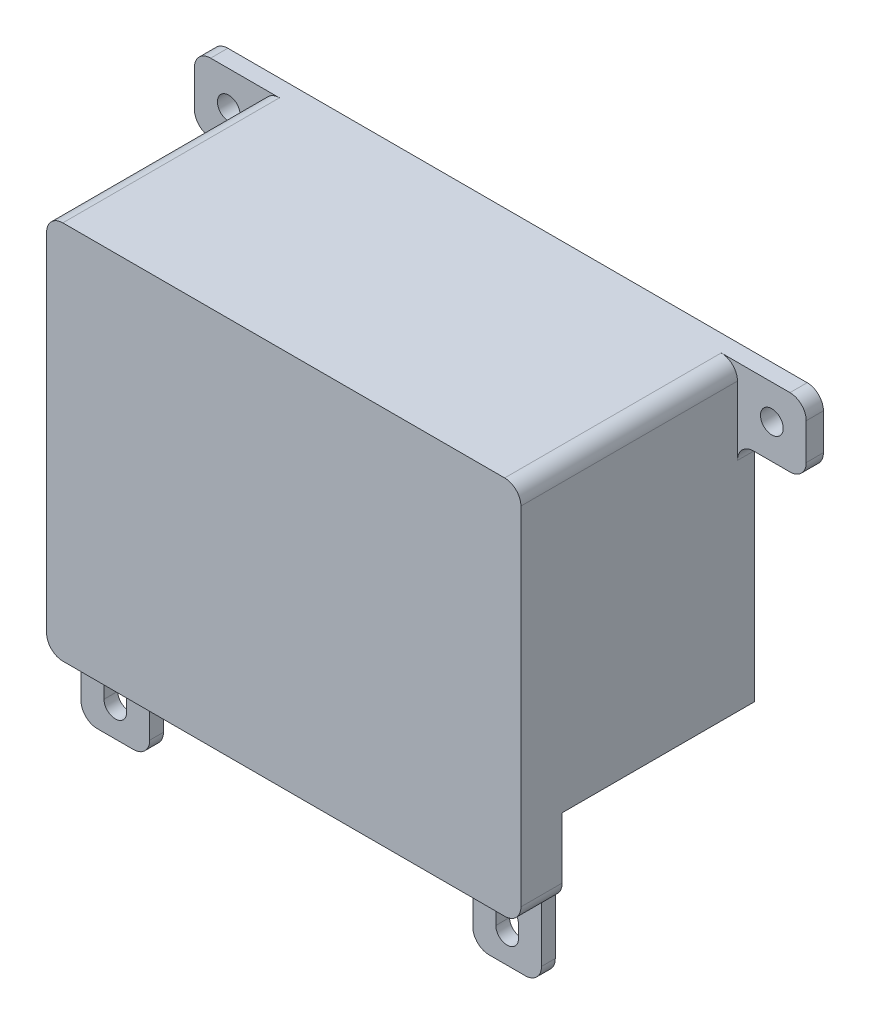
from build123d import *

# Parameters (mm, degrees)
SKETCH1_W           = 82.539998569
SKETCH1_H           = 65.04
BOSS_EXTRUDE1_DEPTH = 43.18
SHELL1_T            = 2.54
CUT_EXTRUDE2_DEPTH  = 124.028758627
SKETCH7_W           = 87.619998569
SKETCH7_H           = 43.18
BOSS_EXTRUDE2_DEPTH = 2.54
CUT_EXTRUDE3_DEPTH  = 2.54
CUT_EXTRUDE4_DEPTH  = 2.54
SKETCH10_W          = 1.27
SKETCH10_H          = 35.56
CUT_EXTRUDE5_DEPTH  = 2.54
SKETCH11_W          = 12.7
SKETCH11_H          = 2.54
BOSS_EXTRUDE3_DEPTH = 12.7
CUT_EXTRUDE7_DEPTH  = 125.717897357
SKETCH13_W          = 12.7
SKETCH13_H          = 12.7
SKETCH13_R          = 2.1
BOSS_EXTRUDE4_DEPTH = 3.175
FILLET2_R           = 3


with BuildPart() as part:
    # Sketch1 → Boss-Extrude1 (new body)
    with BuildSketch(Plane.XY):
        with Locations((47.599999189, 40.75)):
            Rectangle(SKETCH1_W, SKETCH1_H)
    extrude(amount=BOSS_EXTRUDE1_DEPTH)

    # Shell1
    shell1_openings = [part.faces().sort_by_distance(p)[0] for p in [
        (47.599999189, 73.27, 21.59),
        (47.599999189, 40.75, 0),
    ]]
    offset(amount=SHELL1_T, openings=shell1_openings, kind=Kind.INTERSECTION)

    # Sketch6 → Cut-Extrude2 (cut, through all)
    with BuildSketch(Plane.ZY.offset(-3.789999905)):
        Polygon((2.54, 59.03), (2.54, 73.27), (0, 73.27), (0, 59.03), (0, 3.15), (38.1, 3.15), (38.1, 19.92924), (2.54, 19.92924), align=None)
    extrude(amount=-CUT_EXTRUDE2_DEPTH, mode=Mode.SUBTRACT)

    # Sketch7 → Boss-Extrude2 (add)
    with BuildSketch(Plane(origin=(0, 73.27, 0), x_dir=(1, 0, 0), z_dir=(0, 1, 0))):
        with Locations((47.59999919, -24.13)):
            Rectangle(SKETCH7_W, SKETCH7_H)
    extrude(amount=BOSS_EXTRUDE2_DEPTH)

    # Sketch8 → Cut-Extrude3 (cut)
    with BuildSketch(Plane(origin=(0, 0, 2.54), x_dir=(-1, 0, 0), z_dir=(0, 0, -1))):
        Polygon((-65.405564728, 73.27), (-65.405564728, 74.54), (-90.139998474, 74.54), (-90.139998474, 19.92924), (-88.869998474, 19.92924), (-88.869998474, 73.27), align=None)
        Polygon((-5.059999905, 74.54), (-65.405564728, 74.54), (-65.405564728, 73.27), (-6.329999905, 73.27), (-6.329999905, 19.92924), (-5.059999905, 19.92924), align=None)
    extrude(amount=-CUT_EXTRUDE3_DEPTH, mode=Mode.SUBTRACT)

    # Sketch9 → Cut-Extrude4 (cut)
    with BuildSketch(Plane(origin=(0, 0, 38.1), x_dir=(-1, 0, 0), z_dir=(0, 0, -1))):
        Polygon((-90.139998474, 19.92924), (-90.139998474, 6.96), (-5.059999905, 6.96), (-5.059999905, 19.92924), (-6.329999905, 19.92924), (-6.329999905, 8.23), (-88.869998474, 8.23), (-88.869998474, 19.92924), align=None)
    extrude(amount=-CUT_EXTRUDE4_DEPTH, mode=Mode.SUBTRACT)

    # Sketch10 → Cut-Extrude5 (cut)
    with BuildSketch(Plane.XZ.offset(-19.92924)):
        with Locations((5.694999905, 22.86)):
            Rectangle(SKETCH10_W, SKETCH10_H)
        with Locations((89.504998474, 22.86)):
            Rectangle(SKETCH10_W, SKETCH10_H)
    extrude(amount=-CUT_EXTRUDE5_DEPTH, mode=Mode.SUBTRACT)

    # Sketch11 → Boss-Extrude3 (add)
    with BuildSketch(Plane.XZ.offset(-5.69)):
        with Locations((11.409999905, 39.37)):
            Rectangle(SKETCH11_W, SKETCH11_H)
        with Locations((83.789998474, 39.37)):
            Rectangle(SKETCH11_W, SKETCH11_H)
    extrude(amount=BOSS_EXTRUDE3_DEPTH)

    # Sketch12 → Cut-Extrude7 (cut, through all)
    with BuildSketch(Plane.XY.offset(40.64)):
        with BuildLine():
            Line((9.309999905, 0.61), (9.309999905, -1.683510845))
            ThreePointArc((9.309999905, -1.683510845), (11.409999905, -3.783510845), (13.509999905, -1.683510845))
            Line((13.509999905, -1.683510845), (13.509999905, 0.61))
            ThreePointArc((13.509999905, 0.61), (11.409999905, 2.71), (9.309999905, 0.61))
        make_face()
        with BuildLine():
            Line((81.689998474, 0.61), (81.689998474, -1.683510845))
            ThreePointArc((81.689998474, -1.683510845), (83.789998474, -3.783510845), (85.889998474, -1.683510845))
            Line((85.889998474, -1.683510845), (85.889998474, 0.61))
            ThreePointArc((85.889998474, 0.61), (83.789998474, 2.71), (81.689998474, 0.61))
        make_face()
    extrude(amount=-CUT_EXTRUDE7_DEPTH, mode=Mode.SUBTRACT)

    # Sketch13 → Boss-Extrude4 (add)
    # profile 1 of 2: a face of its own
    with BuildSketch(Plane(origin=(0, 0, 2.54), x_dir=(-1, 0, 0), z_dir=(0, 0, -1))):
        with Locations((-97.759998474, 69.46)):
            Rectangle(SKETCH13_W, SKETCH13_H)
        with Locations((-97.759998474, 69.46)):
            Circle(SKETCH13_R, mode=Mode.SUBTRACT)
    # profile 2 of 2: a face of its own
    with BuildSketch(Plane(origin=(0, 0, 2.54), x_dir=(-1, 0, 0), z_dir=(0, 0, -1))):
        with Locations((2.560000095, 69.46)):
            Rectangle(SKETCH13_W, SKETCH13_H)
        with Locations((2.560000095, 69.46)):
            Circle(SKETCH13_R, mode=Mode.SUBTRACT)
    extrude(amount=-BOSS_EXTRUDE4_DEPTH)

    # Fillet2
    fillet2_edges = [part.edges().sort_by_distance(p)[0] for p in [
        (17.759999905, 5.69, 39.37),
        (5.059999905, -7.01, 39.37),
        (17.759999905, -7.01, 39.37),
        (77.439998474, 5.69, 39.37),
        (90.139998474, -7.01, 39.37),
        (77.439998474, -7.01, 39.37),
        (91.409998474, 63.11, 4.1275),
        (104.109998474, 63.11, 4.1275),
        (104.109998474, 75.81, 4.1275),
        (3.789999905, 75.81, 25.7175),
        (3.789999905, 63.11, 4.1275),
        (-8.910000095, 75.81, 4.1275),
        (-8.910000095, 63.11, 4.1275),
        (91.409998474, 75.81, 25.7175),
        (91.409998474, 5.69, 41.91),
        (3.789999905, 5.69, 41.91),
    ]]
    fillet(fillet2_edges, radius=FILLET2_R)


solid = part.part
